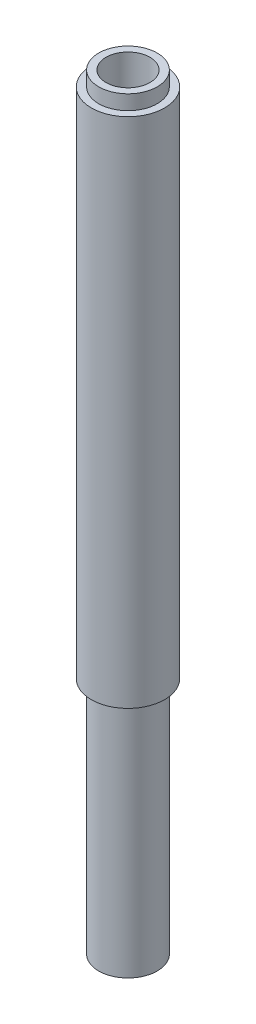
from build123d import *

# Parameters (mm, degrees)
SKETCH1_R           = 12.7
BOSS_EXTRUDE1_DEPTH = 177.8
SKETCH4_R           = 10.16
BOSS_EXTRUDE2_DEPTH = 5.08
SKETCH5_R           = 7.62
CUT_EXTRUDE1_DEPTH  = 184.759828036
SKETCH6_R           = 10.16
SKETCH6_R_2         = 7.62
BOSS_EXTRUDE3_DEPTH = 82.804


with BuildPart() as part:
    # Sketch1 → Boss-Extrude1 (new body)
    with BuildSketch(Plane(origin=(0, 0, 0), x_dir=(1, 0, 0), z_dir=(0, 1, 0))):
        with Locations(Location((0, 0, 0), (0, 0, 270))):
            Circle(SKETCH1_R)
    extrude(amount=BOSS_EXTRUDE1_DEPTH)

    # Sketch4 → Boss-Extrude2 (add)
    with BuildSketch(Plane(origin=(0, 177.8, 0), x_dir=(1, 0, 0), z_dir=(0, 1, 0))):
        with Locations(Location((0, 0, 0), (0, 0, 270))):
            Circle(SKETCH4_R)
    extrude(amount=BOSS_EXTRUDE2_DEPTH)

    # Sketch5 → Cut-Extrude1 (cut, through all)
    with BuildSketch(Plane(origin=(0, 182.88, 0), x_dir=(1, 0, 0), z_dir=(0, 1, 0))):
        with Locations(Location((0, 0, 0), (0, 0, 270))):
            Circle(SKETCH5_R)
    extrude(amount=-CUT_EXTRUDE1_DEPTH, mode=Mode.SUBTRACT)

    # Sketch6 → Boss-Extrude3 (add)
    with BuildSketch(Plane.XZ):
        with Locations(Location((0, 0, 0), (0, 0, 90))):
            Circle(SKETCH6_R)
        with Locations(Location((0, 0, 0), (0, 0, 90))):
            Circle(SKETCH6_R_2, mode=Mode.SUBTRACT)
    extrude(amount=BOSS_EXTRUDE3_DEPTH)


solid = part.part
